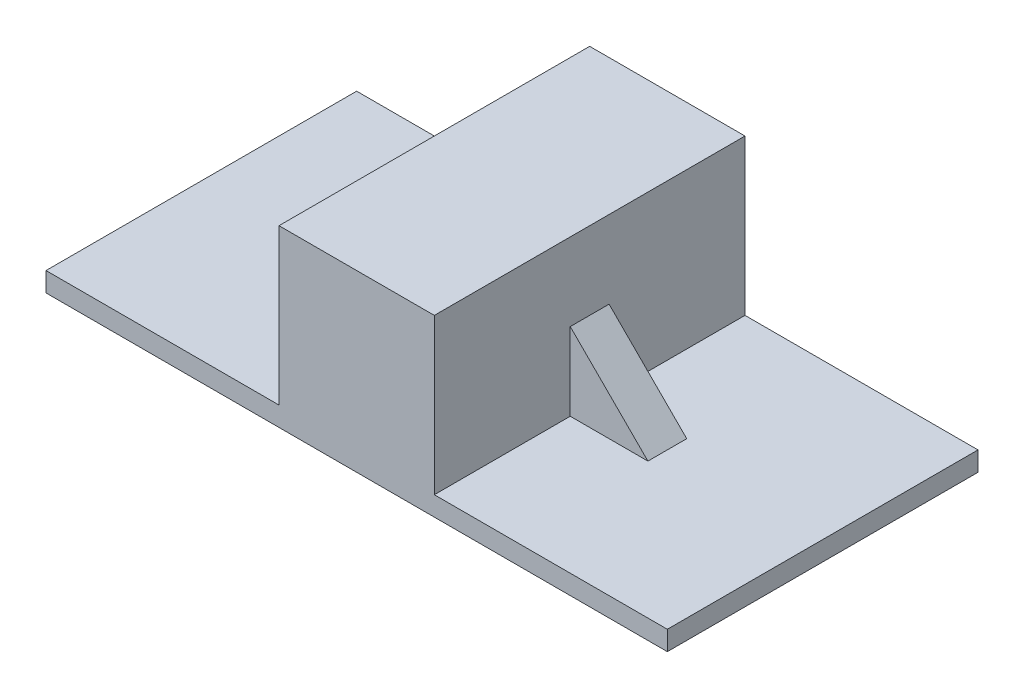
from build123d import *

# Parameters (mm, degrees)
SKETCH1_W           = 203.2
SKETCH1_H           = 101.6
BOSS_EXTRUDE2_DEPTH = 6.35
SKETCH3_W           = 50.8
SKETCH3_H           = 101.6
BOSS_EXTRUDE3_DEPTH = 50.8
BOSS_EXTRUDE4_DEPTH = 6.35


with BuildPart() as part:
    # Sketch1 → Boss-Extrude2 (new body)
    with BuildSketch(Plane(origin=(0, 0, 0), x_dir=(1, 0, 0), z_dir=(0, 1, 0))):
        with Locations((101.6, 50.8)):
            Rectangle(SKETCH1_W, SKETCH1_H)
    extrude(amount=BOSS_EXTRUDE2_DEPTH)

    # Sketch3 → Boss-Extrude3 (add)
    with BuildSketch(Plane(origin=(0, 6.35, 0), x_dir=(1, 0, 0), z_dir=(0, 1, 0))):
        with Locations((101.6, 50.8)):
            Rectangle(SKETCH3_W, SKETCH3_H)
    extrude(amount=BOSS_EXTRUDE3_DEPTH)

    # Sketch4 → Boss-Extrude4 (add, symmetric)
    with BuildSketch(Plane.XY.offset(-50.8)):
        Polygon((127, 31.75), (152.4, 6.35), (127, 6.35), align=None)
        Polygon((76.2, 31.75), (50.8, 6.35), (76.2, 6.35), align=None)
    extrude(amount=BOSS_EXTRUDE4_DEPTH, both=True)


solid = part.part
